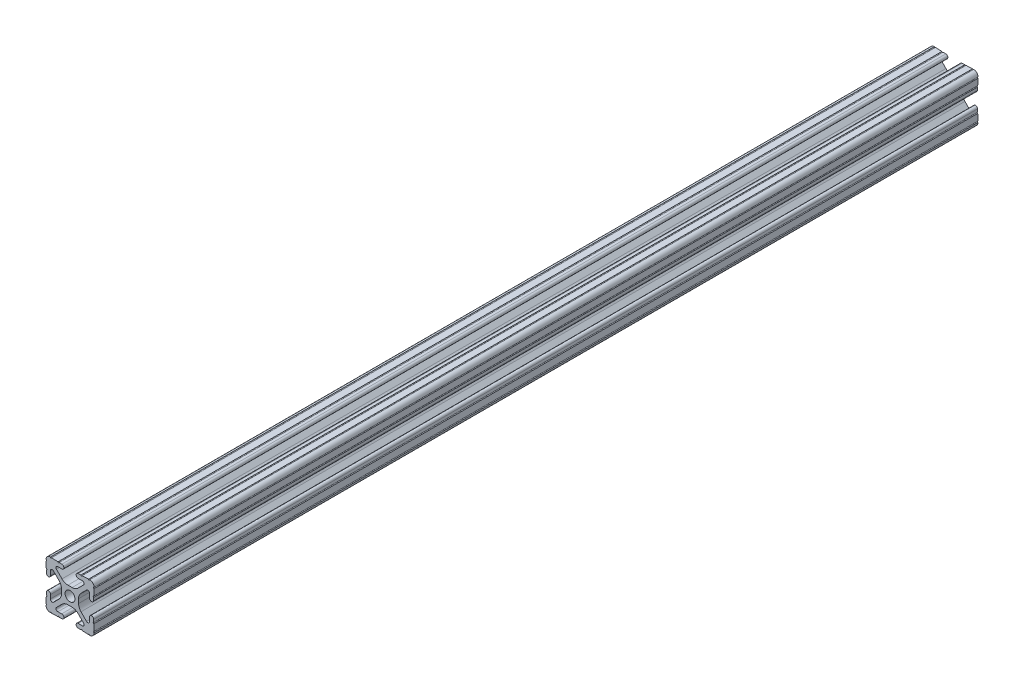
from build123d import *

# Parameters (mm, degrees)
SKETCH3_R      = 2.6035
EXTRUDE1_DEPTH = 233.5875


with BuildPart() as part:
    # Sketch3 → Extrude1 (new, symmetric)
    with BuildSketch(Plane.XY):
        with BuildLine():
            Line((-1.115277175, 4.5085), (1.115277175, 4.5085))
            ThreePointArc((1.115277175, 4.5085), (2.806584872, 4.844922018), (4.240406305, 5.80297087))
            Line((4.240406305, 5.80297087), (7.148423664, 8.710988229))
            ThreePointArc((7.148423664, 8.710988229), (7.349906316, 9.772227925), (6.436353897, 10.348636575))
            Line((6.436353897, 10.348636575), (4.381960454, 10.276895575))
            ThreePointArc((4.381960454, 10.276895575), (3.239173075, 11.342562046), (4.304839546, 12.485349424))
            Line((4.304839546, 12.485349424), (5.728246175, 12.535055879))
            ThreePointArc((5.728246175, 12.535055879), (6.054756855, 12.230579745), (6.35923299, 12.557090424))
            Line((6.35923299, 12.557090424), (9.782092278, 12.676619304))
            ThreePointArc((9.782092278, 12.676619304), (10.108602958, 12.37214317), (10.413079092, 12.69865385))
            ThreePointArc((10.413079092, 12.69865385), (12.052764565, 12.052764565), (12.69865385, 10.413079092))
            ThreePointArc((12.69865385, 10.413079092), (12.37214317, 10.108602958), (12.676619304, 9.782092278))
            Line((12.676619304, 9.782092278), (12.557090424, 6.35923299))
            ThreePointArc((12.557090424, 6.35923299), (12.230579745, 6.054756855), (12.535055879, 5.728246175))
            Line((12.535055879, 5.728246175), (12.485349424, 4.304839546))
            ThreePointArc((12.485349424, 4.304839546), (11.342562046, 3.239173075), (10.276895575, 4.381960454))
            Line((10.276895575, 4.381960454), (10.348636575, 6.436353897))
            ThreePointArc((10.348636575, 6.436353897), (9.772227925, 7.349906316), (8.710988229, 7.148423664))
            Line((8.710988229, 7.148423664), (5.80297087, 4.240406305))
            ThreePointArc((5.80297087, 4.240406305), (4.844922018, 2.806584872), (4.5085, 1.115277175))
            Line((4.5085, 1.115277175), (4.5085, -1.115277175))
            ThreePointArc((4.5085, -1.115277175), (4.844922018, -2.806584872), (5.80297087, -4.240406305))
            Line((5.80297087, -4.240406305), (8.710988229, -7.148423664))
            ThreePointArc((8.710988229, -7.148423664), (9.772227925, -7.349906316), (10.348636575, -6.436353897))
            Line((10.348636575, -6.436353897), (10.276895575, -4.381960454))
            ThreePointArc((10.276895575, -4.381960454), (11.342562046, -3.239173075), (12.485349424, -4.304839546))
            Line((12.485349424, -4.304839546), (12.535055879, -5.728246175))
            ThreePointArc((12.535055879, -5.728246175), (12.230579745, -6.054756855), (12.557090424, -6.35923299))
            Line((12.557090424, -6.35923299), (12.676619304, -9.782092278))
            ThreePointArc((12.676619304, -9.782092278), (12.37214317, -10.108602958), (12.69865385, -10.413079092))
            ThreePointArc((12.69865385, -10.413079092), (12.052764565, -12.052764565), (10.413079092, -12.69865385))
            ThreePointArc((10.413079092, -12.69865385), (10.108602958, -12.37214317), (9.782092278, -12.676619304))
            Line((9.782092278, -12.676619304), (6.35923299, -12.557090424))
            ThreePointArc((6.35923299, -12.557090424), (6.054756855, -12.230579745), (5.728246175, -12.535055879))
            Line((5.728246175, -12.535055879), (4.304839546, -12.485349424))
            ThreePointArc((4.304839546, -12.485349424), (3.239173075, -11.342562046), (4.381960454, -10.276895575))
            Line((4.381960454, -10.276895575), (6.436353897, -10.348636575))
            ThreePointArc((6.436353897, -10.348636575), (7.349906316, -9.772227925), (7.148423664, -8.710988229))
            Line((7.148423664, -8.710988229), (4.240406305, -5.80297087))
            ThreePointArc((4.240406305, -5.80297087), (2.806584872, -4.844922018), (1.115277175, -4.5085))
            Line((1.115277175, -4.5085), (-1.115277175, -4.5085))
            ThreePointArc((-1.115277175, -4.5085), (-2.806584872, -4.844922018), (-4.240406305, -5.80297087))
            Line((-4.240406305, -5.80297087), (-7.148423664, -8.710988229))
            ThreePointArc((-7.148423664, -8.710988229), (-7.349906316, -9.772227925), (-6.436353897, -10.348636575))
            Line((-6.436353897, -10.348636575), (-4.381960454, -10.276895575))
            ThreePointArc((-4.381960454, -10.276895575), (-3.239173075, -11.342562046), (-4.304839546, -12.485349424))
            Line((-4.304839546, -12.485349424), (-5.728246175, -12.535055879))
            ThreePointArc((-5.728246175, -12.535055879), (-6.054756855, -12.230579745), (-6.35923299, -12.557090424))
            Line((-6.35923299, -12.557090424), (-9.782092278, -12.676619304))
            ThreePointArc((-9.782092278, -12.676619304), (-10.108602958, -12.37214317), (-10.413079092, -12.69865385))
            ThreePointArc((-10.413079092, -12.69865385), (-12.052764565, -12.052764565), (-12.69865385, -10.413079092))
            ThreePointArc((-12.69865385, -10.413079092), (-12.37214317, -10.108602958), (-12.676619304, -9.782092278))
            Line((-12.676619304, -9.782092278), (-12.557090424, -6.35923299))
            ThreePointArc((-12.557090424, -6.35923299), (-12.230579745, -6.054756855), (-12.535055879, -5.728246175))
            Line((-12.535055879, -5.728246175), (-12.485349424, -4.304839546))
            ThreePointArc((-12.485349424, -4.304839546), (-11.342562046, -3.239173075), (-10.276895575, -4.381960454))
            Line((-10.276895575, -4.381960454), (-10.348636575, -6.436353897))
            ThreePointArc((-10.348636575, -6.436353897), (-9.772227925, -7.349906316), (-8.710988229, -7.148423664))
            Line((-8.710988229, -7.148423664), (-5.80297087, -4.240406305))
            ThreePointArc((-5.80297087, -4.240406305), (-4.844922018, -2.806584872), (-4.5085, -1.115277175))
            Line((-4.5085, -1.115277175), (-4.5085, 1.115277175))
            ThreePointArc((-4.5085, 1.115277175), (-4.844922018, 2.806584872), (-5.80297087, 4.240406305))
            Line((-5.80297087, 4.240406305), (-8.710988229, 7.148423664))
            ThreePointArc((-8.710988229, 7.148423664), (-9.772227925, 7.349906316), (-10.348636575, 6.436353897))
            Line((-10.348636575, 6.436353897), (-10.276895575, 4.381960454))
            ThreePointArc((-10.276895575, 4.381960454), (-11.342562046, 3.239173075), (-12.485349424, 4.304839546))
            Line((-12.485349424, 4.304839546), (-12.535055879, 5.728246175))
            ThreePointArc((-12.535055879, 5.728246175), (-12.230579745, 6.054756855), (-12.557090424, 6.35923299))
            Line((-12.557090424, 6.35923299), (-12.676619304, 9.782092278))
            ThreePointArc((-12.676619304, 9.782092278), (-12.37214317, 10.108602958), (-12.69865385, 10.413079092))
            ThreePointArc((-12.69865385, 10.413079092), (-12.052764565, 12.052764565), (-10.413079092, 12.69865385))
            ThreePointArc((-10.413079092, 12.69865385), (-10.108602958, 12.37214317), (-9.782092278, 12.676619304))
            Line((-9.782092278, 12.676619304), (-6.35923299, 12.557090424))
            ThreePointArc((-6.35923299, 12.557090424), (-6.054756855, 12.230579745), (-5.728246175, 12.535055879))
            Line((-5.728246175, 12.535055879), (-4.304839546, 12.485349424))
            ThreePointArc((-4.304839546, 12.485349424), (-3.239173075, 11.342562046), (-4.381960454, 10.276895575))
            Line((-4.381960454, 10.276895575), (-6.436353897, 10.348636575))
            ThreePointArc((-6.436353897, 10.348636575), (-7.349906316, 9.772227925), (-7.148423664, 8.710988229))
            Line((-7.148423664, 8.710988229), (-4.240406305, 5.80297087))
            ThreePointArc((-4.240406305, 5.80297087), (-2.806584872, 4.844922018), (-1.115277175, 4.5085))
        make_face()
        Circle(SKETCH3_R, mode=Mode.SUBTRACT)
    extrude(amount=EXTRUDE1_DEPTH, both=True)


solid = part.part
